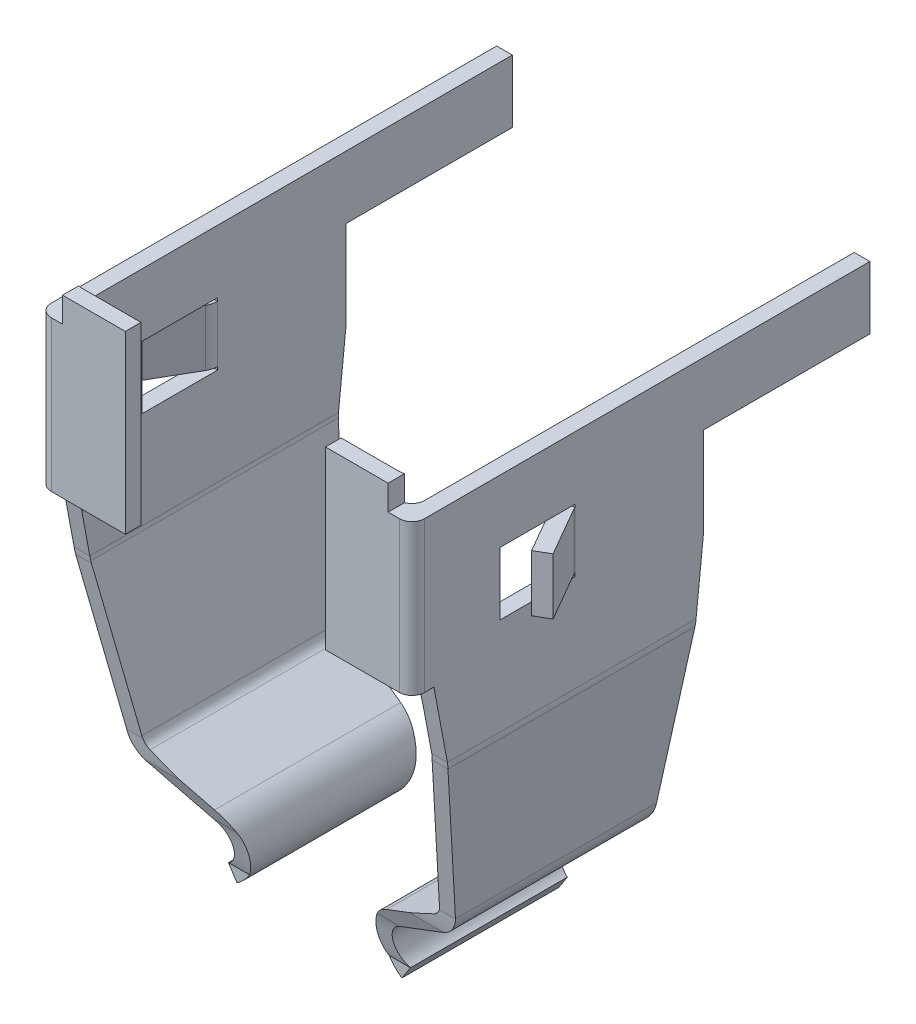
from build123d import *

# Parameters (mm, degrees)
DODANIE_WYCI_GNI_CIE1_DEPTH = 7.3
DODANIE_WYCI_GNI_CIE2_DEPTH = 0.25
WYTNIJ_WYCI_GNI_CIE2_DEPTH  = 12.167282267
WYTNIJ_WYCI_GNI_CIE3_DEPTH  = 12.167282285
ZAOKR_GLENIE1_R             = 0.2
ZAOKR_GLENIE2_R             = 0.2
DODANIE_WYCI_GNI_CIE3_START = 0.05
DODANIE_WYCI_GNI_CIE3_DEPTH = 0.9


with BuildPart() as part:
    # Szkic1 → Dodanie-wyciągnięcie1 (new body)
    with BuildSketch(Plane.XY):
        with BuildLine():
            Line((1.405116335, 4.204317468), (1.057183583, 1.728647296))
            ThreePointArc((1.057183583, 1.728647296), (1.021953073, 1.640341325), (0.949928069, 1.578280612))
            Line((0.949928069, 1.578280612), (0.058921545, 1.124290112))
            ThreePointArc((0.058921545, 1.124290112), (-0.295093828, 0.579154241), (0, 0))
            Line((0, 0), (0.136159757, 0.209667643))
            ThreePointArc((0.136159757, 0.209667643), (-0.045436444, 0.566070253), (0.17241917, 0.901538481))
            Line((0.17241917, 0.901538481), (1.063425694, 1.355528981))
            ThreePointArc((1.063425694, 1.355528981), (1.225481952, 1.495165587), (1.3047506, 1.693854021))
            Line((1.3047506, 1.693854021), (1.652683352, 4.169524193))
            ThreePointArc((1.652683352, 4.169524193), (1.658155338, 4.221586663), (1.659982301, 4.273904019))
            Line((1.659982301, 4.273904019), (1.659982301, 5.42145891))
            Line((1.659982301, 5.42145891), (1.659982301, 7.82145891))
            Line((1.659982301, 7.82145891), (1.409982301, 7.82145891))
            Line((1.409982301, 7.82145891), (1.409982301, 5.42145891))
            Line((1.409982301, 5.42145891), (1.409982301, 4.273904019))
            ThreePointArc((1.409982301, 4.273904019), (1.408764326, 4.239025782), (1.405116335, 4.204317468))
        make_face()
    extrude(amount=DODANIE_WYCI_GNI_CIE1_DEPTH)

    # Szkic2 → Dodanie-wyciągnięcie2 (add)
    with BuildSketch(Plane.XY.offset(7.3)):
        Polygon((1.355163819, 5.42145891), (1.655163819, 5.42145891), (1.655163819, 7.82145891), (1.355163819, 7.82145891), (1.280163818, 7.82145891), (1.280163818, 8.22145891), (0.280163815, 8.22145891), (0.280163815, 5.42145891), align=None)
    extrude(amount=-DODANIE_WYCI_GNI_CIE2_DEPTH)

    # Szkic5 → Wytnij-wyciągnięcie2 (cut, through all)
    with BuildSketch(Plane(origin=(1.659982301, 0, 0), x_dir=(0, 0, -1), z_dir=(1, 0, 0))):
        Polygon((-5.9, 5.82145891), (-5.9, 6.82145891), (-4.7, 6.82145891), (-4.7, 6.77145891), (-4.7, 5.87145891), (-4.7, 5.82145891), align=None)
        with BuildLine():
            Line((-3.3, 0.209667643), (-3.3, 0))
            Line((-3.3, 0), (0.677517739, -1.842302501))
            Line((0.677517739, -1.842302501), (2.05755561, 3.652844369))
            Line((2.05755561, 3.652844369), (0, 6.82145891))
            Line((0, 6.82145891), (0, 4.273904019))
            Line((0, 4.273904019), (-2.771358189, 4.273904019))
            add(Edge.make_bspline(
                [(-2.780586941, 4.169524193), (-2.77751069, 4.20409107), (-2.77443444, 4.238997434), (-2.771358189, 4.273904019)],
                knots=[0, 0, 0, 0, 1, 1, 1, 1], degree=3))
            Line((-2.780586941, 4.169524193), (-3.04497122, 1.693854021))
            add(Edge.make_bspline(
                [(-3.077964009, 1.355528981), (-3.06687125, 1.421464567), (-3.056063979, 1.550031836), (-3.04497122, 1.693854021)],
                knots=[0, 0, 0, 0, 1, 1, 1, 1], degree=3))
            Line((-3.077964009, 1.355528981), (-3.183717721, 0.901538481))
            add(Edge.make_bspline(
                [(-3.3, 0.209667643), (-3.29030981, 0.24769062), (-3.28061962, 0.30133568), (-3.26123924, 0.42574366), (-3.25154905, 0.496352759), (-3.23216867, 0.635787746), (-3.22247848, 0.704441234), (-3.203098101, 0.821541736), (-3.193407911, 0.869843965), (-3.183717721, 0.901538481)],
                knots=[0, 0, 0, 0, 0.25, 0.25, 0.5, 0.5, 0.75, 0.75, 1, 1, 1, 1], degree=3))
        make_face()
        with BuildLine():
            Line((-7, -1.842302501), (-5.8, 0))
            Line((-5.8, 0), (-5.8, 0.209667643))
            add(Edge.make_bspline(
                [(-6.005730187, 0.901538481), (-6.000661096, 0.892167233), (-5.995576462, 0.881337895), (-5.985438419, 0.857142657), (-5.980355945, 0.843708737), (-5.970218955, 0.814640367), (-5.965135365, 0.798924265), (-5.954996083, 0.765680027), (-5.949912341, 0.74805828), (-5.939773265, 0.711434436), (-5.934690231, 0.69232914), (-5.929621877, 0.672765989), (-5.927093091, 0.663005221), (-5.924562549, 0.653110489), (-5.922033629, 0.643125228), (-5.916965008, 0.623112133), (-5.911881046, 0.602649314), (-5.901741778, 0.5615423), (-5.89665792, 0.540782481), (-5.891588534, 0.520180818), (-5.889059233, 0.509901898), (-5.886528348, 0.499640559), (-5.883999416, 0.489441806), (-5.87893077, 0.469000815), (-5.873848413, 0.448725956), (-5.863710855, 0.409221102), (-5.858626574, 0.389880105), (-5.853557107, 0.371289718), (-5.851027765, 0.362014297), (-5.848496808, 0.352905444), (-5.84596738, 0.344003192), (-5.840897739, 0.326160734), (-5.835814098, 0.309076097), (-5.825686069, 0.277050711), (-5.820612684, 0.262016545), (-5.810374041, 0.23407951), (-5.805178757, 0.221153274), (-5.8, 0.209667643)],
                knots=[0, 0, 0, 0, 6.3766e-05, 6.3766e-05, 0.000127532, 0.000127532, 0.000191297, 0.000191297, 0.000255063, 0.000255063, 0.000318829, 0.000318829, 0.000318829, 0.000350576, 0.000350576, 0.000350576, 0.000414342, 0.000414342, 0.000478108, 0.000478108, 0.000478108, 0.000509855, 0.000509855, 0.000509855, 0.000573621, 0.000573621, 0.000637387, 0.000637387, 0.000637387, 0.000669134, 0.000669134, 0.000669134, 0.0007329, 0.0007329, 0.000796552, 0.000796552, 0.000861705, 0.000861705, 0.000861705, 0.000861705], degree=3))
            Line((-6.005730187, 0.901538481), (-6.192832907, 1.355528981))
            add(Edge.make_bspline(
                [(-6.251204765, 1.693854021), (-6.231580916, 1.550045034), (-6.212456756, 1.421458516), (-6.192832907, 1.355528981)],
                knots=[0, 0, 0, 0, 1, 1, 1, 1], degree=3))
            Line((-6.251204765, 1.693854021), (-6.718961566, 4.169524193))
            add(Edge.make_bspline(
                [(-6.735289358, 4.273904019), (-6.732562201, 4.256406846), (-6.729834153, 4.238907143), (-6.724392226, 4.20409032), (-6.72167633, 4.186759916), (-6.718961566, 4.169524193)],
                knots=[0, 0, 0, 0, 5.3125e-05, 5.3125e-05, 0.000105995, 0.000105995, 0.000105995, 0.000105995], degree=3))
            Line((-6.735289358, 4.273904019), (-7.3, 4.273904019))
            Line((-7.3, 4.273904019), (-7.3, 5.42145891))
            Line((-7.3, 5.42145891), (-10.052370219, -0.174444269))
            Line((-10.052370219, -0.174444269), (-7, -1.842302501))
        make_face()
    extrude(amount=-WYTNIJ_WYCI_GNI_CIE2_DEPTH, mode=Mode.SUBTRACT)

    # Szkic5<5> → Wytnij-wyciągnięcie3 (cut, through all)
    with BuildSketch(Plane(origin=(1.659982301, 0, 0), x_dir=(0, 0, -1), z_dir=(1, 0, 0))):
        Polygon((-7, 5.42145891), (-7.3, 5.42145891), (-7.3, 4.273904019), (-6.735289358, 4.273904019), (-6.95, 5.42145891), align=None)
        Polygon((0, 4.273904019), (0, 6.82145891), (-2.65, 6.82145891), (-2.65, 5.42145891), (-2.771358189, 4.273904019), align=None)
    extrude(amount=-WYTNIJ_WYCI_GNI_CIE3_DEPTH, mode=Mode.SUBTRACT)

    # Zaokrąglenie1
    zaokr_glenie1_edges = [part.edges().sort_by_distance(p)[0] for p in [
        (1.659982301, 6.62145891, 7.3),
    ]]
    fillet(zaokr_glenie1_edges, radius=ZAOKR_GLENIE1_R)

    # Zaokrąglenie2
    zaokr_glenie2_edges = [part.edges().sort_by_distance(p)[0] for p in [
        (1.409982301, 6.62145891, 7.05),
    ]]
    fillet(zaokr_glenie2_edges, radius=ZAOKR_GLENIE2_R)

    # Szkic6 → Dodanie-wyciągnięcie3 (add)
    with BuildSketch(Plane(origin=(0, 5.82145891, 0), x_dir=(1, 0, 0), z_dir=(0, 1, 0)).offset(DODANIE_WYCI_GNI_CIE3_START)):
        with BuildLine():
            Line((1.659982301, -4.7), (1.409982301, -4.7))
            ThreePointArc((1.409982301, -4.7), (1.420204553, -4.777645714), (1.45017468, -4.85))
            Line((1.45017468, -4.85), (1.904359787, -5.636671682))
            Line((1.904359787, -5.636671682), (2.120866138, -5.511671682))
            Line((2.120866138, -5.511671682), (1.66668103, -4.725))
            ThreePointArc((1.66668103, -4.725), (1.661686009, -4.712940952), (1.659982301, -4.7))
        make_face()
    extrude(amount=DODANIE_WYCI_GNI_CIE3_DEPTH)


with BuildPart() as body_2:
    # Lustro2: mirrored copy
    add(part.part.mirror(Plane.ZY.offset(1.315017699)))


solid = Compound([part.part, body_2.part])
